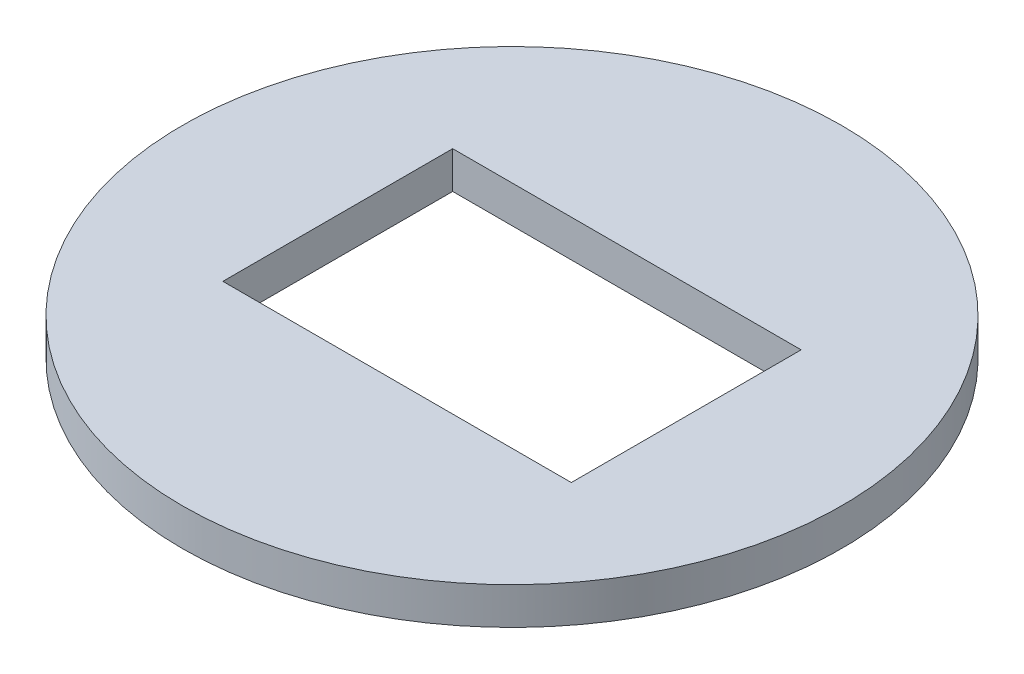
from build123d import *

# Parameters (mm, degrees)
SKETCH1_R           = 88.9
BOSS_EXTRUDE1_DEPTH = 10
SKETCH2_W           = 94
SKETCH2_H           = 62
CUT_EXTRUDE1_DEPTH  = 30


with BuildPart() as part:
    # Sketch1 → Boss-Extrude1 (new body)
    with BuildSketch(Plane(origin=(0, 0, 0), x_dir=(1, 0, 0), z_dir=(0, 1, 0))):
        with Locations(Location((0, 0, 0), (0, 0, 270))):
            Circle(SKETCH1_R)
    extrude(amount=BOSS_EXTRUDE1_DEPTH)

    # Sketch2 → Cut-Extrude1 (cut)
    with BuildSketch(Plane.XZ):
        Rectangle(SKETCH2_W, SKETCH2_H)
    extrude(amount=-CUT_EXTRUDE1_DEPTH, mode=Mode.SUBTRACT)


solid = part.part
